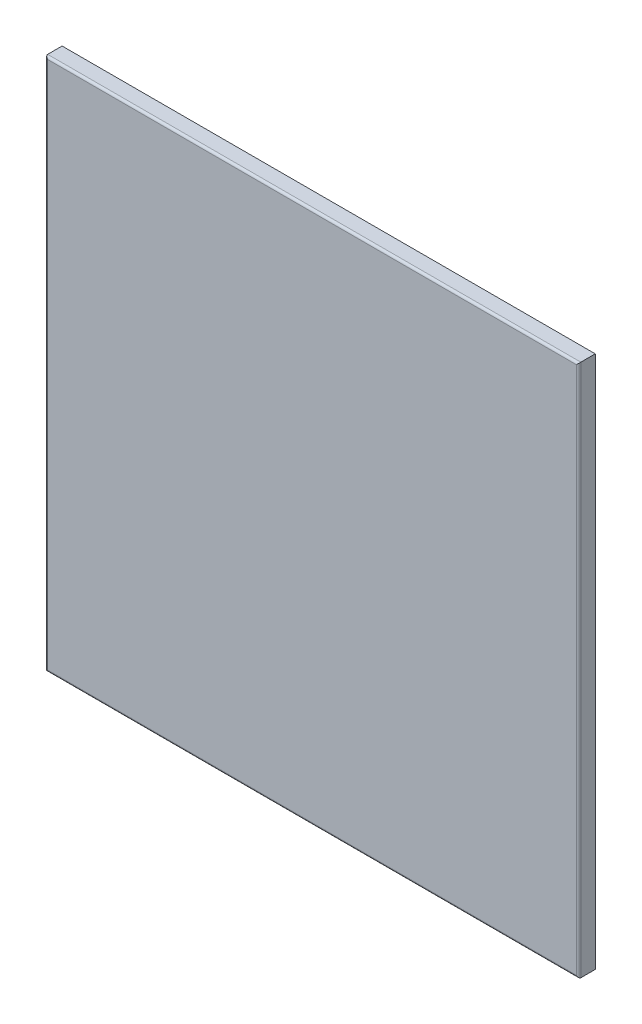
from build123d import *

# Parameters (mm, degrees)
SKETCH1_W           = 609.6
SKETCH1_H           = 609.6
BOSS_EXTRUDE1_DEPTH = 2.54
SKETCH2_W           = 609.6
SKETCH2_H           = 609.6
SKETCH2_W_2         = 604.52
SKETCH2_H_2         = 604.52
BOSS_EXTRUDE2_DEPTH = 19.05
FILLET1_R           = 2.54


with BuildPart() as part:
    # Sketch1 → Boss-Extrude1 (new body)
    with BuildSketch(Plane.XY):
        Rectangle(SKETCH1_W, SKETCH1_H)
    extrude(amount=BOSS_EXTRUDE1_DEPTH)

    # Sketch2 → Boss-Extrude2 (add)
    with BuildSketch(Plane.XY.offset(2.54)):
        Rectangle(SKETCH2_W, SKETCH2_H)
        Rectangle(SKETCH2_W_2, SKETCH2_H_2, mode=Mode.SUBTRACT)
    extrude(amount=-BOSS_EXTRUDE2_DEPTH)

    # Fillet1
    fillet1_edges = [part.edges().sort_by_distance(p)[0] for p in [
        (-304.8, 0, 2.54),
        (0, -304.8, 2.54),
        (304.8, 0, 2.54),
        (0, 304.8, 2.54),
    ]]
    fillet(fillet1_edges, radius=FILLET1_R)


solid = part.part
